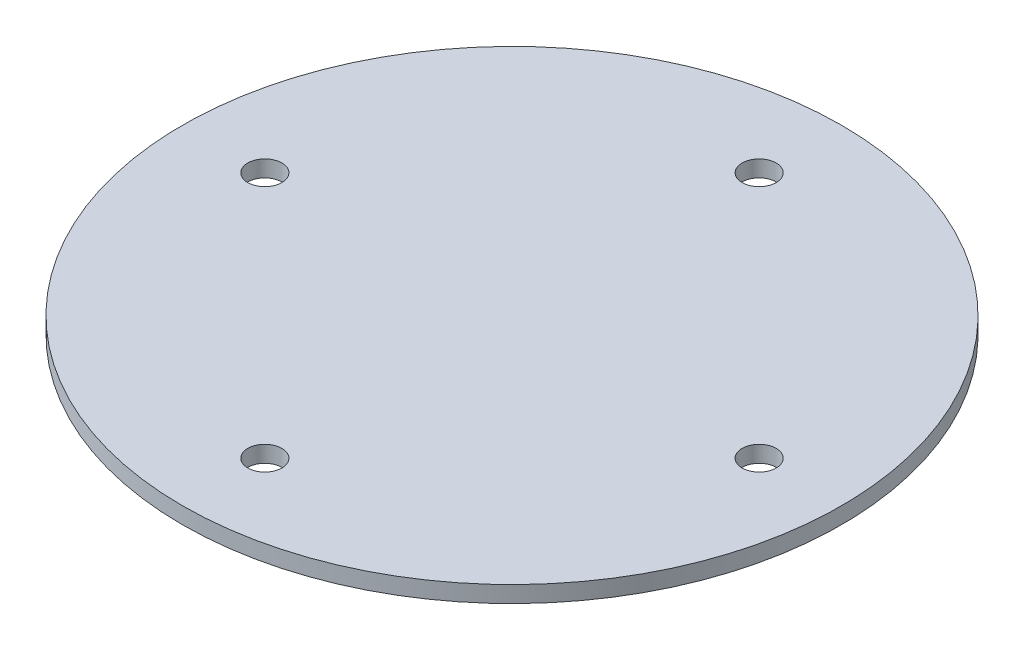
from build123d import *

# Parameters (mm, degrees)
SKETCH1_R           = 60
SKETCH1_R_2         = 3.1
BOSS_EXTRUDE1_DEPTH = 3


with BuildPart() as part:
    # Sketch1 → Boss-Extrude1 (new body)
    with BuildSketch(Plane(origin=(0, 0, 0), x_dir=(1, 0, 0), z_dir=(0, 1, 0))):
        with Locations(Location((0, 0, 0), (0, 0, 270))):
            Circle(SKETCH1_R)
        with Locations(Location((-45, 0, 0), (0, 0, 270))):
            Circle(SKETCH1_R_2, mode=Mode.SUBTRACT)
        with Locations(Location((0, 45, 0), (0, 0, 270))):
            Circle(SKETCH1_R_2, mode=Mode.SUBTRACT)
        with Locations(Location((45, 0, 0), (0, 0, 270))):
            Circle(SKETCH1_R_2, mode=Mode.SUBTRACT)
        with Locations(Location((0, -45, 0), (0, 0, 270))):
            Circle(SKETCH1_R_2, mode=Mode.SUBTRACT)
    extrude(amount=BOSS_EXTRUDE1_DEPTH)


solid = part.part
